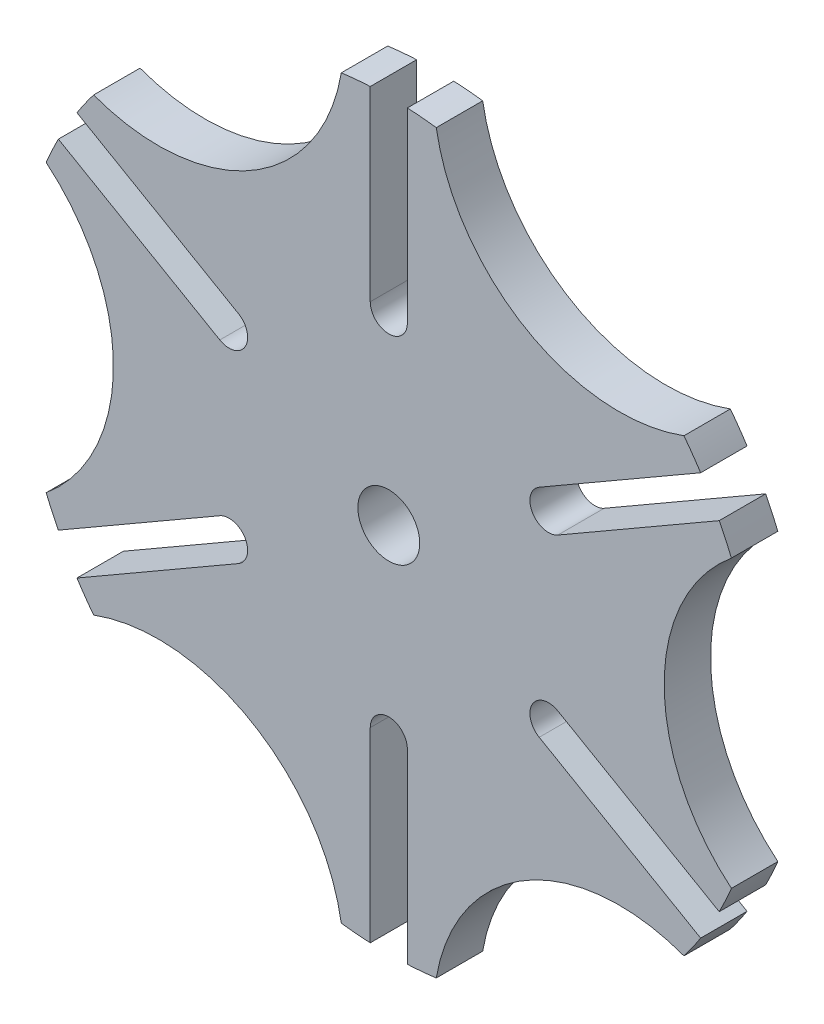
from build123d import *

# Parameters (mm, degrees)
SKETCH2_R           = 6.35
BOSS_EXTRUDE1_DEPTH = 9.525
BOSS_EXTRUDE2_START = 9.525
SKETCH3_R           = 12.7
SKETCH3_R_2         = 6.35
BOSS_EXTRUDE2_DEPTH = 9.525


with BuildPart() as part:
    # Sketch2 → Boss-Extrude1 (new body)
    with BuildSketch(Plane.XY):
        with BuildLine():
            Line((-3.81, 37.846), (-3.81, 76.104690394))
            ThreePointArc((-3.81, 76.104690394), (-6.781597981, 75.897627953), (-9.742832479, 75.574580484))
            ThreePointArc((-9.742832479, 75.574580484), (-28.2575, 48.943425695), (-60.57809034, 46.224830674))
            ThreePointArc((-60.57809034, 46.224830674), (-62.338474903, 43.821850106), (-64.003595229, 41.351901986))
            Line((-64.003595229, 41.351901986), (-30.870597432, 22.222556788))
            ThreePointArc((-30.870597432, 22.222556788), (-29.476040643, 17.018), (-34.680597432, 15.623443212))
            Line((-34.680597432, 15.623443212), (-67.813595229, 34.752788409))
            ThreePointArc((-67.813595229, 34.752788409), (-69.120072885, 32.075777846), (-70.320922819, 29.34974981))
            ThreePointArc((-70.320922819, 29.34974981), (-56.515, 0), (-70.320922819, -29.34974981))
            ThreePointArc((-70.320922819, -29.34974981), (-69.120072885, -32.075777846), (-67.813595229, -34.752788409))
            Line((-67.813595229, -34.752788409), (-34.680597432, -15.623443212))
            ThreePointArc((-34.680597432, -15.623443212), (-29.476040643, -17.018), (-30.870597432, -22.222556788))
            Line((-30.870597432, -22.222556788), (-64.003595229, -41.351901986))
            ThreePointArc((-64.003595229, -41.351901986), (-62.338474903, -43.821850106), (-60.57809034, -46.224830674))
            ThreePointArc((-60.57809034, -46.224830674), (-28.2575, -48.943425695), (-9.742832479, -75.574580484))
            ThreePointArc((-9.742832479, -75.574580484), (-6.781597981, -75.897627953), (-3.81, -76.104690394))
            Line((-3.81, -76.104690394), (-3.81, -37.846))
            ThreePointArc((-3.81, -37.846), (0, -34.036), (3.81, -37.846))
            Line((3.81, -37.846), (3.81, -76.104690394))
            ThreePointArc((3.81, -76.104690394), (6.781597981, -75.897627953), (9.742832479, -75.574580484))
            ThreePointArc((9.742832479, -75.574580484), (28.2575, -48.943425695), (60.57809034, -46.224830674))
            ThreePointArc((60.57809034, -46.224830674), (62.338474903, -43.821850106), (64.003595229, -41.351901986))
            Line((64.003595229, -41.351901986), (30.870597432, -22.222556788))
            ThreePointArc((30.870597432, -22.222556788), (29.476040643, -17.018), (34.680597432, -15.623443212))
            Line((34.680597432, -15.623443212), (67.813595229, -34.752788409))
            ThreePointArc((67.813595229, -34.752788409), (69.120072885, -32.075777846), (70.320922819, -29.34974981))
            ThreePointArc((70.320922819, -29.34974981), (56.515, 0), (70.320922819, 29.34974981))
            ThreePointArc((70.320922819, 29.34974981), (69.120072885, 32.075777846), (67.813595229, 34.752788409))
            Line((67.813595229, 34.752788409), (34.680597432, 15.623443212))
            ThreePointArc((34.680597432, 15.623443212), (29.476040643, 17.018), (30.870597432, 22.222556788))
            Line((30.870597432, 22.222556788), (64.003595229, 41.351901986))
            ThreePointArc((64.003595229, 41.351901986), (62.338474903, 43.821850106), (60.57809034, 46.224830674))
            ThreePointArc((60.57809034, 46.224830674), (28.2575, 48.943425695), (9.742832479, 75.574580484))
            ThreePointArc((9.742832479, 75.574580484), (6.781597981, 75.897627953), (3.81, 76.104690394))
            Line((3.81, 76.104690394), (3.81, 37.846))
            ThreePointArc((3.81, 37.846), (0, 34.036), (-3.81, 37.846))
        make_face()
        with Locations(Location((0, 0, 0), (0, 0, 180))):
            Circle(SKETCH2_R, mode=Mode.SUBTRACT)
    extrude(amount=BOSS_EXTRUDE1_DEPTH)

    # Sketch3 → Boss-Extrude2 (add)
    with BuildSketch(Plane(origin=(0, 0, 0), x_dir=(-1, 0, 0), z_dir=(0, 0, -1)).offset(BOSS_EXTRUDE2_START)):
        with Locations(Location((0, 0, 0), (0, 0, 180))):
            Circle(SKETCH3_R)
        Circle(SKETCH3_R_2, mode=Mode.SUBTRACT)
    extrude(amount=-BOSS_EXTRUDE2_DEPTH)


solid = part.part
